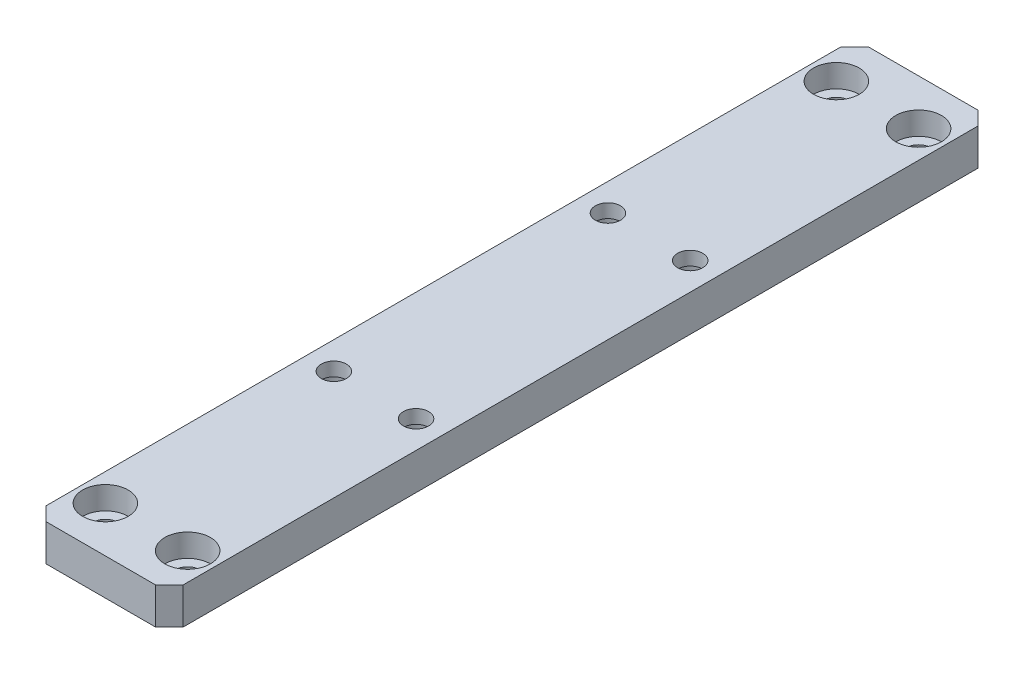
from build123d import *

# Parameters (mm, degrees)
SKETCH1_W                                       = 30
SKETCH1_H                                       = 180
BOSS_EXTRUDE1_DEPTH                             = 8
CHAMFER1_SIZE                                   = 3
CBORE_FOR_M5_SOCKET_HEAD_CAP_SCREW1_D           = 5.5
CBORE_FOR_M5_SOCKET_HEAD_CAP_SCREW1_CBORE_D     = 10
CBORE_FOR_M5_SOCKET_HEAD_CAP_SCREW1_CBORE_DEPTH = 5
CBORE_FOR_M5_SOCKET_HEAD_CAP_SCREW2_D           = 5.5
CBORE_FOR_M5_SOCKET_HEAD_CAP_SCREW2_CBORE_D     = 10
CBORE_FOR_M5_SOCKET_HEAD_CAP_SCREW2_CBORE_DEPTH = 5


with BuildPart() as part:
    # Sketch1 → Boss-Extrude1 (new body)
    with BuildSketch(Plane(origin=(0, 0, 0), x_dir=(1, 0, 0), z_dir=(0, 1, 0))):
        with Locations((15, 0)):
            Rectangle(SKETCH1_W, SKETCH1_H)
    extrude(amount=BOSS_EXTRUDE1_DEPTH)

    # Chamfer1
    chamfer1_edges = [part.edges().sort_by_distance(p)[0] for p in [
        (30, 4, 90),
        (0, 4, 90),
        (0, 4, -90),
        (30, 4, -90),
    ]]
    chamfer(chamfer1_edges, length=CHAMFER1_SIZE)

    # CBORE for M5 Socket Head Cap Screw1 (through all)
    with Locations(Plane(origin=(0, 8, 0), x_dir=(-1, 0, 0), z_dir=(0, 1, 0))):
        with Locations((-6, -80), (-6, 80), (-24, 80), (-24, -80)):
            CounterBoreHole(CBORE_FOR_M5_SOCKET_HEAD_CAP_SCREW1_D / 2, CBORE_FOR_M5_SOCKET_HEAD_CAP_SCREW1_CBORE_D / 2, CBORE_FOR_M5_SOCKET_HEAD_CAP_SCREW1_CBORE_DEPTH)

    # CBORE for M5 Socket Head Cap Screw2 (through all)
    with Locations(Plane.XZ):
        with Locations((6, 30), (6, -30), (24, -30), (24, 30)):
            CounterBoreHole(CBORE_FOR_M5_SOCKET_HEAD_CAP_SCREW2_D / 2, CBORE_FOR_M5_SOCKET_HEAD_CAP_SCREW2_CBORE_D / 2, CBORE_FOR_M5_SOCKET_HEAD_CAP_SCREW2_CBORE_DEPTH)


solid = part.part
